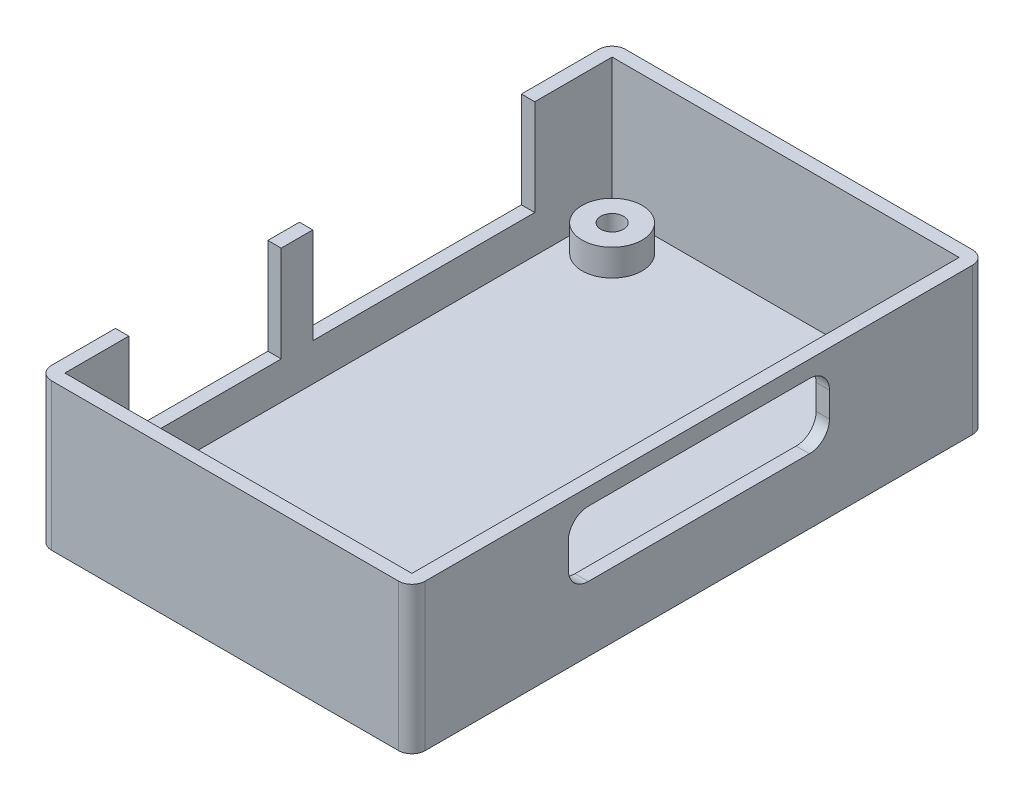
from build123d import *

# Parameters (mm, degrees)
SKIZZE1_W                                    = 56
SKIZZE1_H                                    = 86
AUFSATZ_LINEAR_AUSTRAGEN1_DEPTH              = 22
WANDUNG1_T                                   = -2
SKIZZE2_R                                    = 4.5
AUFSATZ_LINEAR_AUSTRAGEN2_DEPTH              = 4
VERRUNDUNG1_R                                = 2
SKIZZE3_W                                    = 22.84
SKIZZE3_H                                    = 14.38
SCHNITT_LINEAR_AUSTRAGEN1_DEPTH              = 2
STIRNSENKUNG_F_R_M3_ZYLINDERSCHRAUBE_2_COUNT = 2
STIRNSENKUNG_F_R_M3_ZYLINDERSCHRAUBE_2_PITCH = 81.987803971
STIRNSENKUNG_F_R_M3_ZYLINDERSCHRAUBE_3_COUNT = 2
STIRNSENKUNG_F_R_M3_ZYLINDERSCHRAUBE_3_PITCH = 71
STIRNSENKUNG_F_R_M3_ZYLINDERSCHRAUBE_4_COUNT = 2
STIRNSENKUNG_F_R_M3_ZYLINDERSCHRAUBE_4_PITCH = 41
SKIZZE7_W                                    = 33.26
SKIZZE7_H                                    = 14.38
SCHNITT_LINEAR_AUSTRAGEN2_DEPTH              = 10
SKIZZE8_W                                    = 39.14
SKIZZE8_H                                    = 9.76
SCHNITT_LINEAR_AUSTRAGEN3_DEPTH              = 10
VERRUNDUNG2_R                                = 3


with BuildPart() as part:
    # Skizze1 → Aufsatz-Linear austragen1 (new body)
    with BuildSketch(Plane(origin=(0, 0, 0), x_dir=(1, 0, 0), z_dir=(0, 1, 0))):
        with Locations((28, 43)):
            Rectangle(SKIZZE1_W, SKIZZE1_H)
    extrude(amount=AUFSATZ_LINEAR_AUSTRAGEN1_DEPTH)

    # Wandung1
    wandung1_openings = [part.faces().sort_by_distance(p)[0] for p in [
        (28, 22, -43),
    ]]
    offset(amount=WANDUNG1_T, openings=wandung1_openings, kind=Kind.INTERSECTION)

    # Skizze2 → Aufsatz-Linear austragen2 (add)
    with BuildSketch(Plane(origin=(0, 2, 0), x_dir=(1, 0, 0), z_dir=(0, 1, 0))):
        with Locations(Location((7.5, 7.5, 0), (0, 0, 90))):
            Circle(SKIZZE2_R)
        with Locations(Location((48.5, 7.5, 0), (0, 0, 90))):
            Circle(SKIZZE2_R)
        with Locations(Location((48.5, 78.5, 0), (0, 0, 90))):
            Circle(SKIZZE2_R)
        with Locations(Location((7.5, 78.5, 0), (0, 0, 90))):
            Circle(SKIZZE2_R)
    extrude(amount=AUFSATZ_LINEAR_AUSTRAGEN2_DEPTH)

    # Verrundung1
    verrundung1_edges = [part.edges().sort_by_distance(p)[0] for p in [
        (0, 11, -86),
        (56, 11, -86),
        (56, 11, 0),
        (0, 11, 0),
    ]]
    fillet(verrundung1_edges, radius=VERRUNDUNG1_R)

    # Skizze3 → Schnitt-Linear austragen1 (cut)
    with BuildSketch(Plane.ZY):
        with Locations((-23, 14.81)):
            Rectangle(SKIZZE3_W, SKIZZE3_H)
    extrude(amount=-SCHNITT_LINEAR_AUSTRAGEN1_DEPTH, mode=Mode.SUBTRACT)

    # Skizze6 → Stirnsenkung für M3 Zylinderschraube mit Innensechskant1 (revolve, cut)
    with BuildSketch(Plane(origin=(48.5, 0, -7.5), x_dir=(0, 0, -1), z_dir=(1, 0, 0))):
        Polygon((0, 0), (0, 15.021463052), (1.7, 14), (1.7, 3.4), (3.25, 3.4), (3.25, 0.025), (3.275, 0), align=None)
    stirnsenkung_f_r_m3_zylinderschraube_mit = revolve(axis=Axis((48.5, -6.35, -7.5), (0, 1, 0)), mode=Mode.SUBTRACT)

    # Stirnsenkung f_r M3 Zylinderschraube 2: Stirnsenkung für M3 Zylinderschraube mit Innensechskant1 ×2
    with Locations(*[Vector(-0.5000743770922673, 0, -0.865982457891487) * (i * STIRNSENKUNG_F_R_M3_ZYLINDERSCHRAUBE_2_PITCH) for i in range(1, STIRNSENKUNG_F_R_M3_ZYLINDERSCHRAUBE_2_COUNT)]):
        add(stirnsenkung_f_r_m3_zylinderschraube_mit, mode=Mode.SUBTRACT)

    # Stirnsenkung f_r M3 Zylinderschraube 3: Stirnsenkung für M3 Zylinderschraube mit Innensechskant1 ×2
    with Locations(*[(0, 0, -i * STIRNSENKUNG_F_R_M3_ZYLINDERSCHRAUBE_3_PITCH) for i in range(1, STIRNSENKUNG_F_R_M3_ZYLINDERSCHRAUBE_3_COUNT)]):
        add(stirnsenkung_f_r_m3_zylinderschraube_mit, mode=Mode.SUBTRACT)

    # Stirnsenkung f_r M3 Zylinderschraube 4: Stirnsenkung für M3 Zylinderschraube mit Innensechskant1 ×2
    with Locations(*[(-i * STIRNSENKUNG_F_R_M3_ZYLINDERSCHRAUBE_4_PITCH, 0, 0) for i in range(1, STIRNSENKUNG_F_R_M3_ZYLINDERSCHRAUBE_4_COUNT)]):
        add(stirnsenkung_f_r_m3_zylinderschraube_mit, mode=Mode.SUBTRACT)

    # Skizze7 → Schnitt-Linear austragen2 (cut)
    with BuildSketch(Plane.ZY):
        with Locations((-55.78, 14.81)):
            Rectangle(SKIZZE7_W, SKIZZE7_H)
    extrude(amount=-SCHNITT_LINEAR_AUSTRAGEN2_DEPTH, mode=Mode.SUBTRACT)

    # Skizze8 → Schnitt-Linear austragen3 (cut)
    with BuildSketch(Plane(origin=(56, 0, 0), x_dir=(0, 0, -1), z_dir=(1, 0, 0))):
        with Locations((43, 14.62)):
            Rectangle(SKIZZE8_W, SKIZZE8_H)
    extrude(amount=-SCHNITT_LINEAR_AUSTRAGEN3_DEPTH, mode=Mode.SUBTRACT)

    # Verrundung2
    verrundung2_edges = [part.edges().sort_by_distance(p)[0] for p in [
        (55, 9.74, -23.43),
        (55, 19.5, -23.43),
        (55, 19.5, -62.57),
        (55, 9.74, -62.57),
    ]]
    fillet(verrundung2_edges, radius=VERRUNDUNG2_R)


solid = part.part
